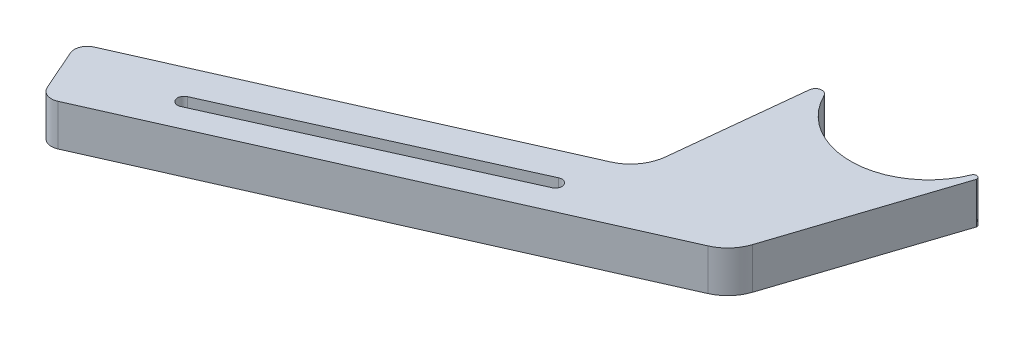
from build123d import *

# Parameters (mm, degrees)
BOSS_EXTRUDE1_DEPTH = 6.35


with BuildPart() as part:
    # Sketch1 → Boss-Extrude1 (new body)
    with BuildSketch(Plane(origin=(0, 0, 0), x_dir=(1, 0, 0), z_dir=(0, 1, 0))):
        with BuildLine():
            Line((-12.660316566, -13.672486937), (-14.793671701, -33.72155142))
            ThreePointArc((-14.793671701, -33.72155142), (-15.910435011, -36.619656083), (-18.326632738, -38.571106689))
            Line((-18.326632738, -38.571106689), (-73.332068985, -62.976257477))
            ThreePointArc((-73.332068985, -62.976257477), (-74.387185899, -64.085254343), (-74.349087019, -65.615513872))
            Line((-74.349087019, -65.615513872), (-71.53446378, -71.959239443))
            ThreePointArc((-71.53446378, -71.959239443), (-70.425466914, -73.014356356), (-68.895207385, -72.976257477))
            Line((-68.895207385, -72.976257477), (0.303992163, -42.273530354))
            ThreePointArc((0.303992163, -42.273530354), (2.320082288, -40.814341122), (3.57063844, -38.662606492))
            Line((3.57063844, -38.662606492), (12.082791936, -12.764755482))
            ThreePointArc((12.082791936, -12.764755482), (11.691090758, -12.25206691), (11.120053366, -12.552392867))
            ThreePointArc((11.120053366, -12.552392867), (0.429889276, -20.034212045), (-10.768550895, -13.337036209))
            ThreePointArc((-10.768550895, -13.337036209), (-11.84052795, -12.793656499), (-12.660316566, -13.672486937))
        make_face()
        with BuildLine():
            Line((-59.558046082, -62.405054335), (-20.220801555, -44.680449865))
            ThreePointArc((-20.220801555, -44.680449865), (-18.898273358, -45.181368191), (-19.399191684, -46.503896387))
            Line((-19.399191684, -46.503896387), (-58.736436211, -64.228500857))
            ThreePointArc((-58.736436211, -64.228500857), (-60.058964408, -63.727582531), (-59.558046082, -62.405054335))
        make_face(mode=Mode.SUBTRACT)
    extrude(amount=BOSS_EXTRUDE1_DEPTH)


solid = part.part
